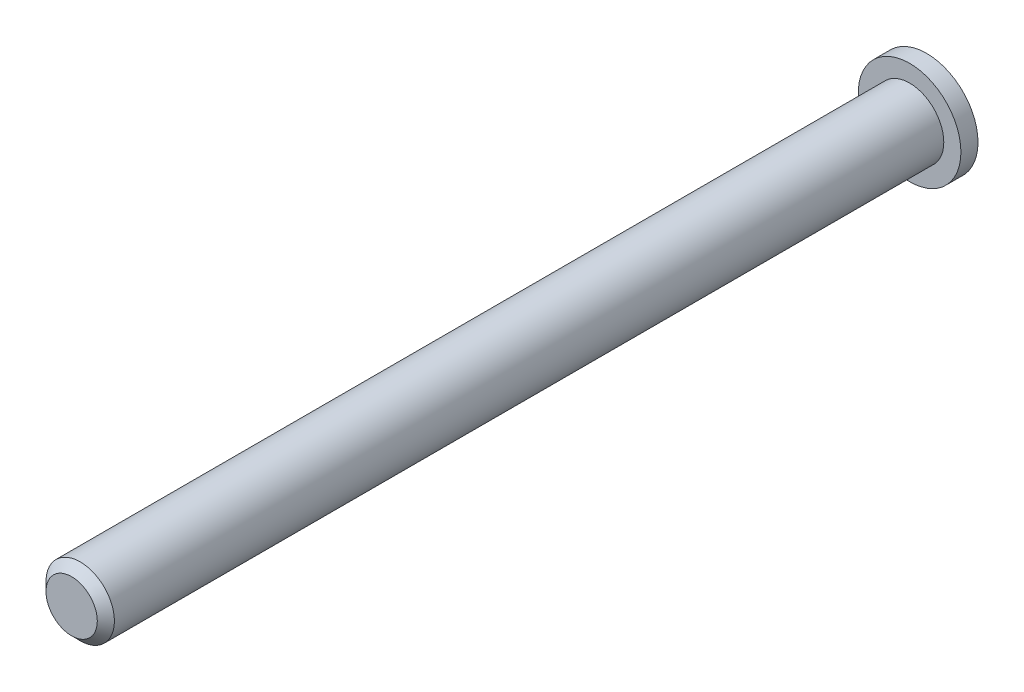
from build123d import *

# Parameters (mm, degrees)
SKETCH1_R           = 1.5
BOSS_EXTRUDE1_DEPTH = 0.5
SKETCH2_R           = 1
BOSS_EXTRUDE2_DEPTH = 24.5
CHAMFER1_SIZE       = 0.25


with BuildPart() as part:
    # Sketch1 → Boss-Extrude1 (new body)
    with BuildSketch(Plane.XY):
        Circle(SKETCH1_R)
    extrude(amount=BOSS_EXTRUDE1_DEPTH)

    # Sketch2 → Boss-Extrude2 (add)
    with BuildSketch(Plane.XY.offset(0.5)):
        Circle(SKETCH2_R)
    extrude(amount=BOSS_EXTRUDE2_DEPTH)

    # Chamfer1
    chamfer1_edges = [part.edges().sort_by_distance(p)[0] for p in [
        (-1, 0, 25),
    ]]
    chamfer(chamfer1_edges, length=CHAMFER1_SIZE)


solid = part.part
